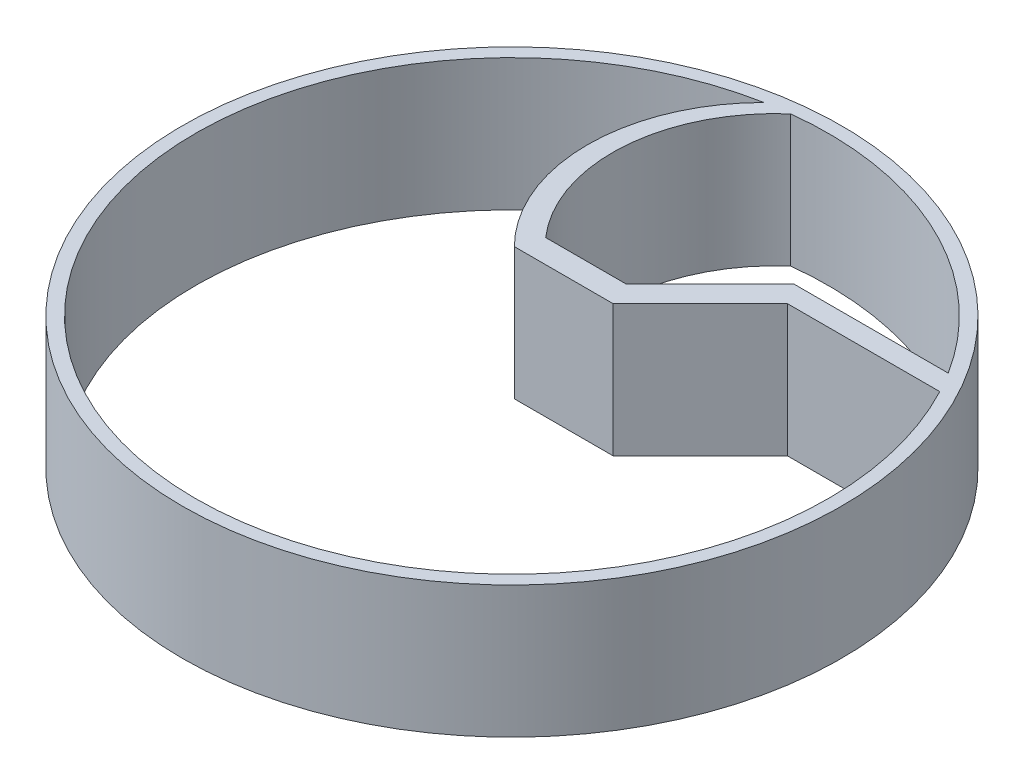
from build123d import *

# Parameters (mm, degrees)
SKETCH1_R           = 2.5
SKETCH1_R_2         = 2.4
BOSS_EXTRUDE1_DEPTH = 1
BOSS_EXTRUDE2_DEPTH = 1


with BuildPart() as part:
    # Sketch1 → Boss-Extrude1 (new body)
    with BuildSketch(Plane(origin=(0, 0, 0), x_dir=(1, 0, 0), z_dir=(0, 1, 0))):
        with Locations(Location((0, 0, 0), (0, 0, 270))):
            Circle(SKETCH1_R)
        with Locations(Location((0, 0, 0), (0, 0, 270))):
            Circle(SKETCH1_R_2, mode=Mode.SUBTRACT)
    extrude(amount=BOSS_EXTRUDE1_DEPTH)

    # Sketch2 → Boss-Extrude2 (add)
    with BuildSketch(Plane(origin=(0, 0, 0), x_dir=(1, 0, 0), z_dir=(0, 1, 0))):
        with BuildLine():
            Line((2.119648162, 1.125651664), (0.964151756, 1.125651664))
            Line((0.964151756, 1.125651664), (0.302943091, 0.464443))
            Line((0.302943091, 0.464443), (-0.446002173, 0.464443))
            ThreePointArc((-0.446002173, 0.464443), (-0.838210984, 1.411318831), (-0.446002173, 2.358194662))
            ThreePointArc((-0.446002173, 2.358194662), (-0.358295432, 2.373104377), (-0.27009636, 2.384753228))
            ThreePointArc((-0.27009636, 2.384753228), (-0.689298485, 1.537997556), (-0.386972473, 0.642830213))
            Line((-0.386972473, 0.642830213), (0.22293871, 0.642830213))
            Line((0.22293871, 0.642830213), (0.859210068, 1.279101571))
            Line((0.859210068, 1.279101571), (2.030738577, 1.279101571))
            ThreePointArc((2.030738577, 1.279101571), (2.07661124, 1.203198138), (2.119648162, 1.125651664))
        make_face()
    extrude(amount=BOSS_EXTRUDE2_DEPTH)


solid = part.part
